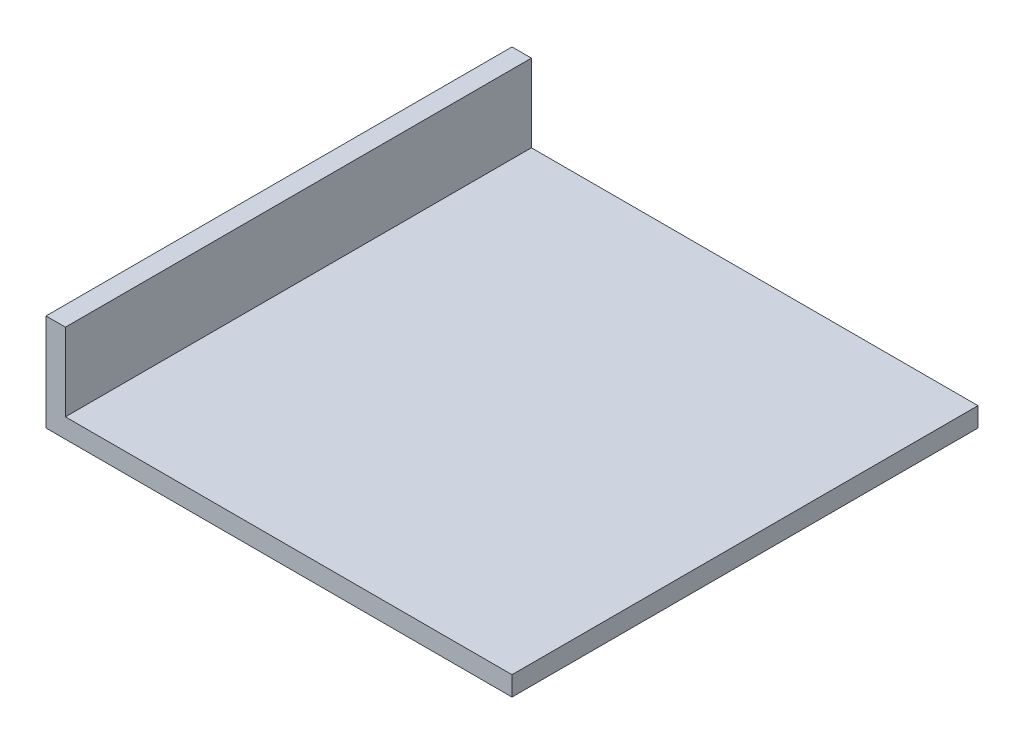
from build123d import *

# Parameters (mm, degrees)
SKETCH1_W           = 609.6
SKETCH1_H           = 609.6
BOSS_EXTRUDE1_DEPTH = 25.4
SKETCH2_W           = 25.4
SKETCH2_H           = 609.6
BOSS_EXTRUDE2_DEPTH = 101.6


with BuildPart() as part:
    # Sketch1 → Boss-Extrude1 (new body)
    with BuildSketch(Plane(origin=(0, 0, 0), x_dir=(1, 0, 0), z_dir=(0, 1, 0))):
        Rectangle(SKETCH1_W, SKETCH1_H)
    extrude(amount=BOSS_EXTRUDE1_DEPTH)

    # Sketch2 → Boss-Extrude2 (add)
    with BuildSketch(Plane(origin=(0, 25.4, 0), x_dir=(1, 0, 0), z_dir=(0, 1, 0))):
        with Locations((-292.1, 0)):
            Rectangle(SKETCH2_W, SKETCH2_H)
    extrude(amount=BOSS_EXTRUDE2_DEPTH)


solid = part.part
